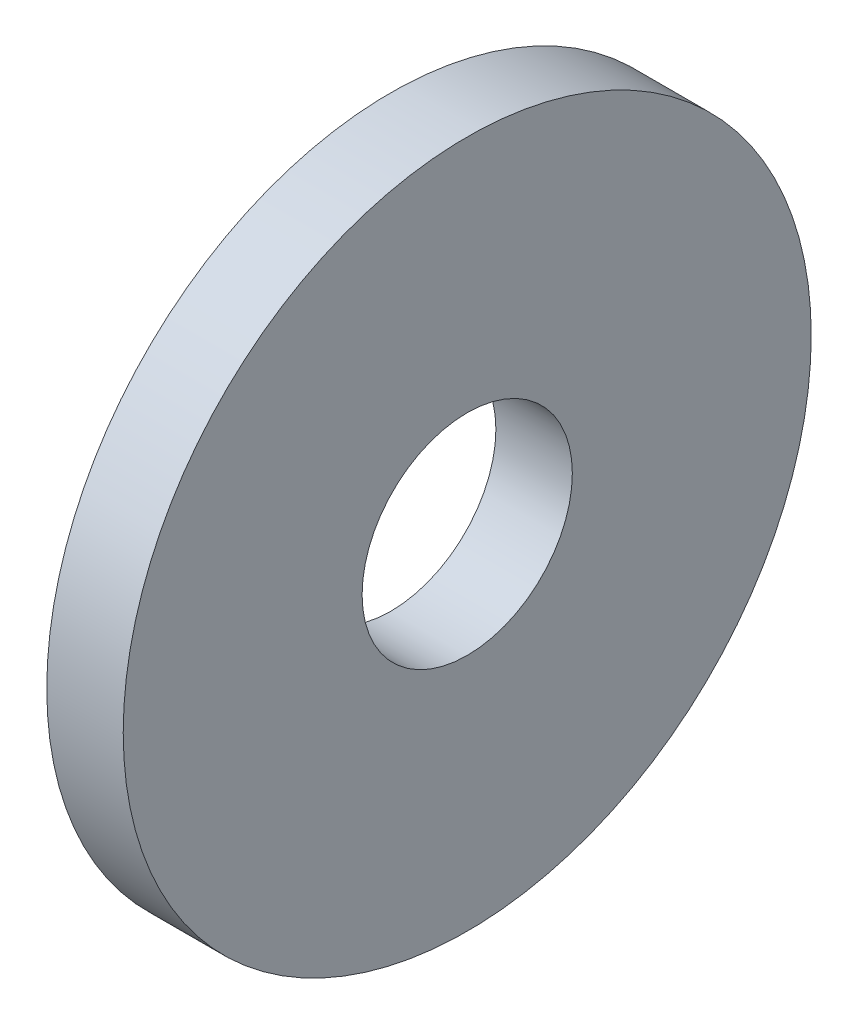
from build123d import *

# Parameters (mm, degrees)
SKETCH1_W = 2
SKETCH1_H = 6.25


with BuildPart() as part:
    # Sketch1 → Base-Revolve (revolve)
    with BuildSketch(Plane.XY, mode=Mode.PRIVATE) as base_revolve_sk:
        with Locations((-1, 5.875)):
            Rectangle(SKETCH1_W, SKETCH1_H)
    revolve(base_revolve_sk.sketch.rotate(Axis((-34.925, 0, 0), (1, 0, 0)), 90), axis=Axis((-34.925, 0, 0), (1, 0, 0)))


solid = part.part
